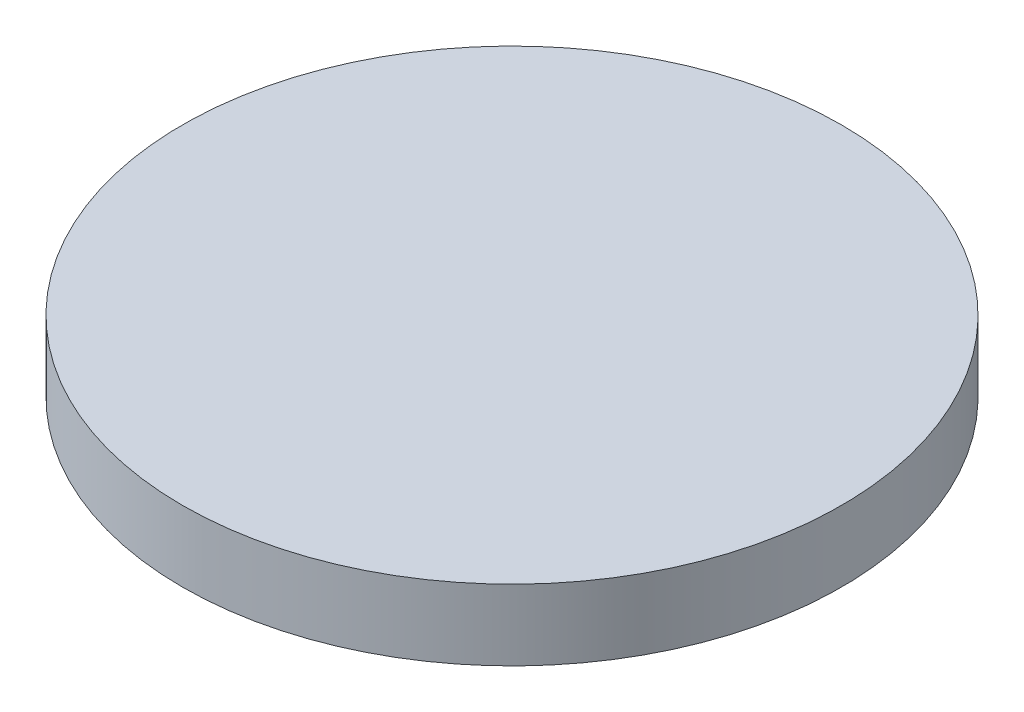
from build123d import *

# Parameters (mm, degrees)
SKETCH1_R           = 41.897090419
SKETCH1_R_2         = 39.897090419
BOSS_EXTRUDE1_DEPTH = 7
SKETCH2_R           = 41.897090419
BOSS_EXTRUDE2_DEPTH = 2


with BuildPart() as part:
    # Sketch1 → Boss-Extrude1 (new body)
    with BuildSketch(Plane(origin=(0, 0, 0), x_dir=(1, 0, 0), z_dir=(0, 1, 0))):
        with Locations(Location((0, 0, 0), (0, 0, 90))):
            Circle(SKETCH1_R)
        with Locations(Location((0, 0, 0), (0, 0, 90))):
            Circle(SKETCH1_R_2, mode=Mode.SUBTRACT)
    extrude(amount=BOSS_EXTRUDE1_DEPTH)

    # Sketch2 → Boss-Extrude2 (add)
    with BuildSketch(Plane(origin=(0, 7, 0), x_dir=(1, 0, 0), z_dir=(0, 1, 0))):
        with Locations(Location((0, 0, 0), (0, 0, 90))):
            Circle(SKETCH2_R)
    extrude(amount=BOSS_EXTRUDE2_DEPTH)


solid = part.part
